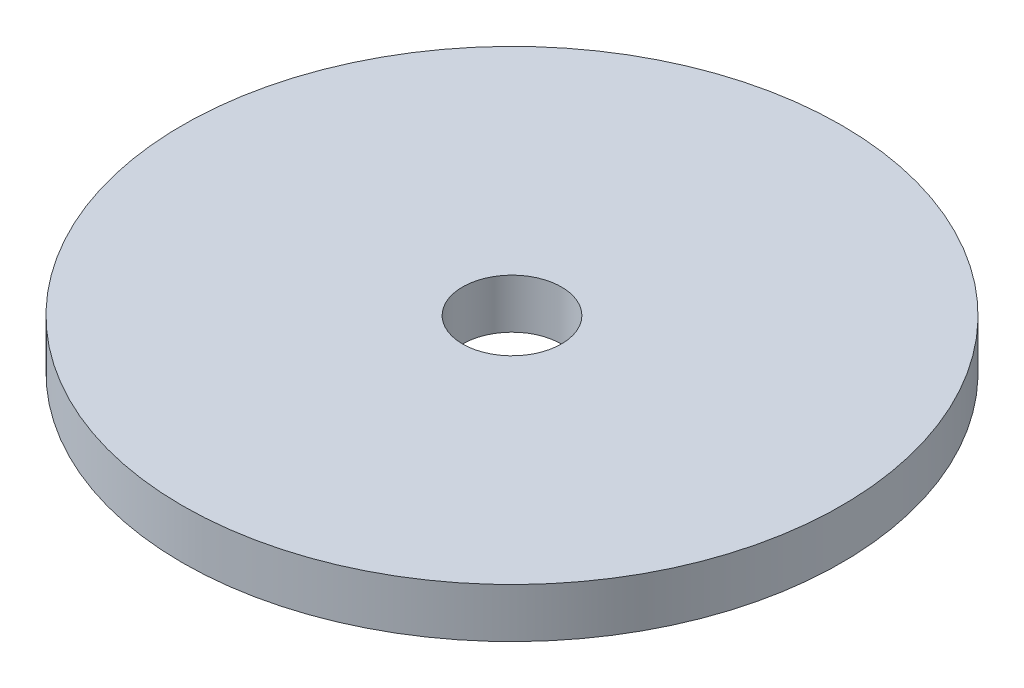
from build123d import *

# Parameters (mm, degrees)
SKETCH1_R           = 40
SKETCH1_R_2         = 6
BOSS_EXTRUDE1_DEPTH = 6


with BuildPart() as part:
    # Sketch1 → Boss-Extrude1 (new body)
    with BuildSketch(Plane(origin=(0, 0, 0), x_dir=(1, 0, 0), z_dir=(0, 1, 0))):
        with Locations(Location((0, 0, 0), (0, 0, 270))):
            Circle(SKETCH1_R)
        with Locations(Location((0, 0, 0), (0, 0, 270))):
            Circle(SKETCH1_R_2, mode=Mode.SUBTRACT)
    extrude(amount=BOSS_EXTRUDE1_DEPTH)


solid = part.part
